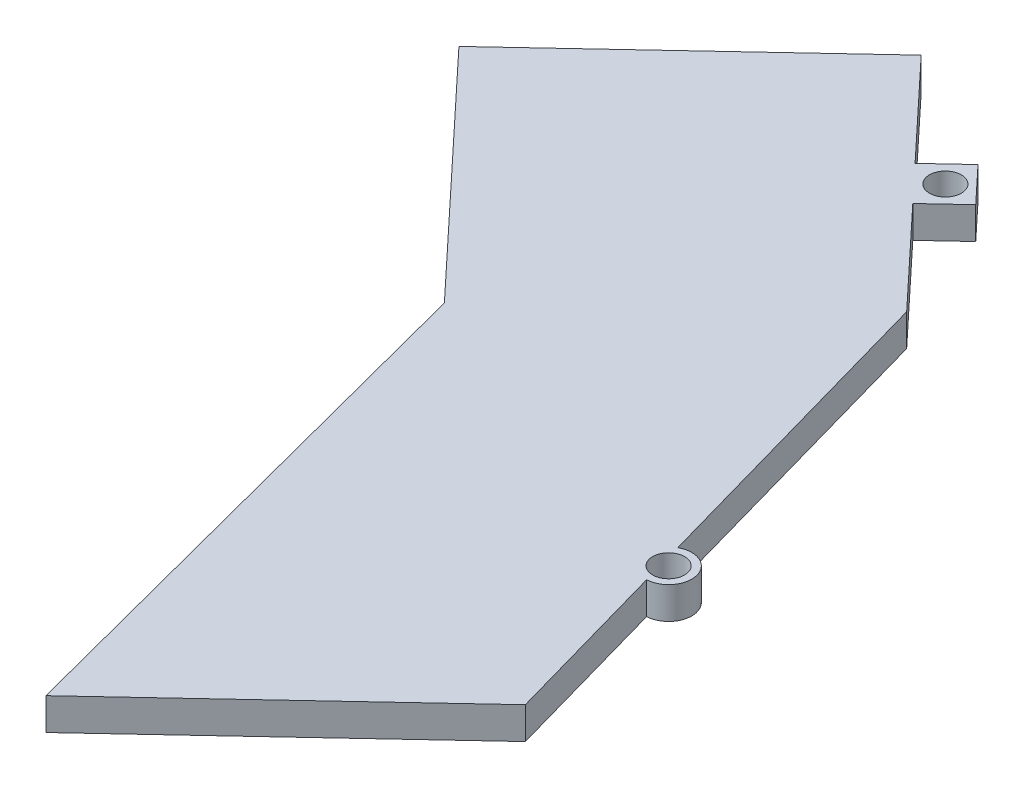
from build123d import *

# Parameters (mm, degrees)
SKETCH1_R           = 3.175
BOSS_EXTRUDE1_DEPTH = 6.35


with BuildPart() as part:
    # Sketch1 → Boss-Extrude1 (new body)
    with BuildSketch(Plane(origin=(0, 0, 0), x_dir=(1, 0, 0), z_dir=(0, 1, 0))):
        with BuildLine():
            Line((59.992329175, -52.562440303), (50.525242276, -18.985043707))
            ThreePointArc((50.525242276, -18.985043707), (54.736759655, -13.141199939), (48.092868173, -10.358019279))
            Line((48.092868173, -10.358019279), (30.218426447, 53.0381685))
            Line((30.218426447, 53.0381685), (12.190853288, 72.285391563))
            Line((12.190853288, 72.285391563), (18.653548719, 78.338561638))
            Line((18.653548719, 78.338561638), (11.968839999, 85.475522266))
            Line((11.968839999, 85.475522266), (5.506144568, 79.422352191))
            Line((5.506144568, 79.422352191), (-12.521428591, 98.669575253))
            Line((-12.521428591, 98.669575253), (-59.992329175, 54.206790652))
            Line((-59.992329175, 54.206790652), (-17.252470825, 8.575380364))
            Line((-17.252470825, 8.575380364), (10.765830225, -98.669575253))
            Line((10.765830225, -98.669575253), (59.992329175, -52.562440303))
        make_face()
        with Locations(Location((12.079948167, 78.880545368, 0), (0, 0, 270))):
            Circle(SKETCH1_R, mode=Mode.SUBTRACT)
        with Locations(Location((50.308887465, -14.389630582, 0), (0, 0, 270))):
            Circle(SKETCH1_R, mode=Mode.SUBTRACT)
    extrude(amount=BOSS_EXTRUDE1_DEPTH)


solid = part.part
